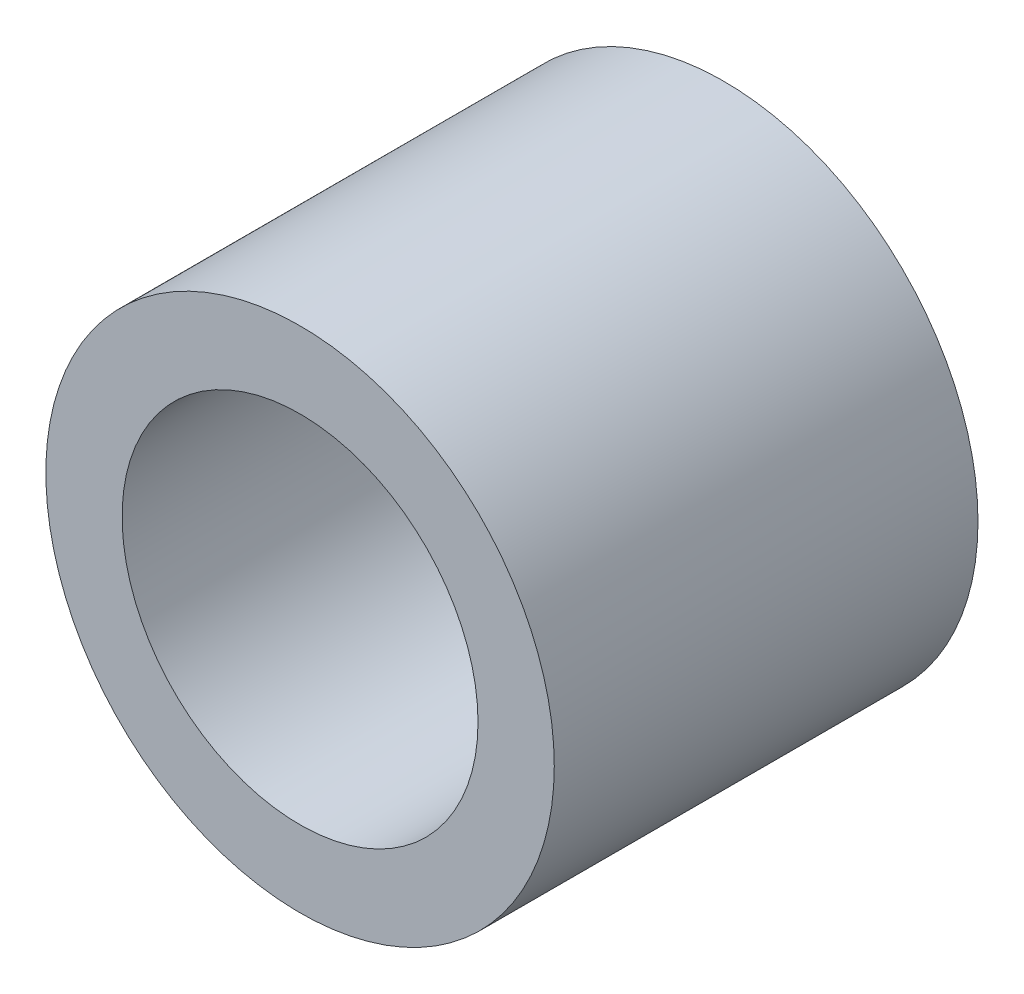
from build123d import *

# Parameters (mm, degrees)
SKETCH1_R    = 1.5
SKETCH1_R_2  = 1.05
SPACER_DEPTH = 2.5


with BuildPart() as part:
    # Sketch1 → Spacer (new body)
    with BuildSketch(Plane.XY):
        Circle(SKETCH1_R)
        Circle(SKETCH1_R_2, mode=Mode.SUBTRACT)
    extrude(amount=SPACER_DEPTH)


solid = part.part
